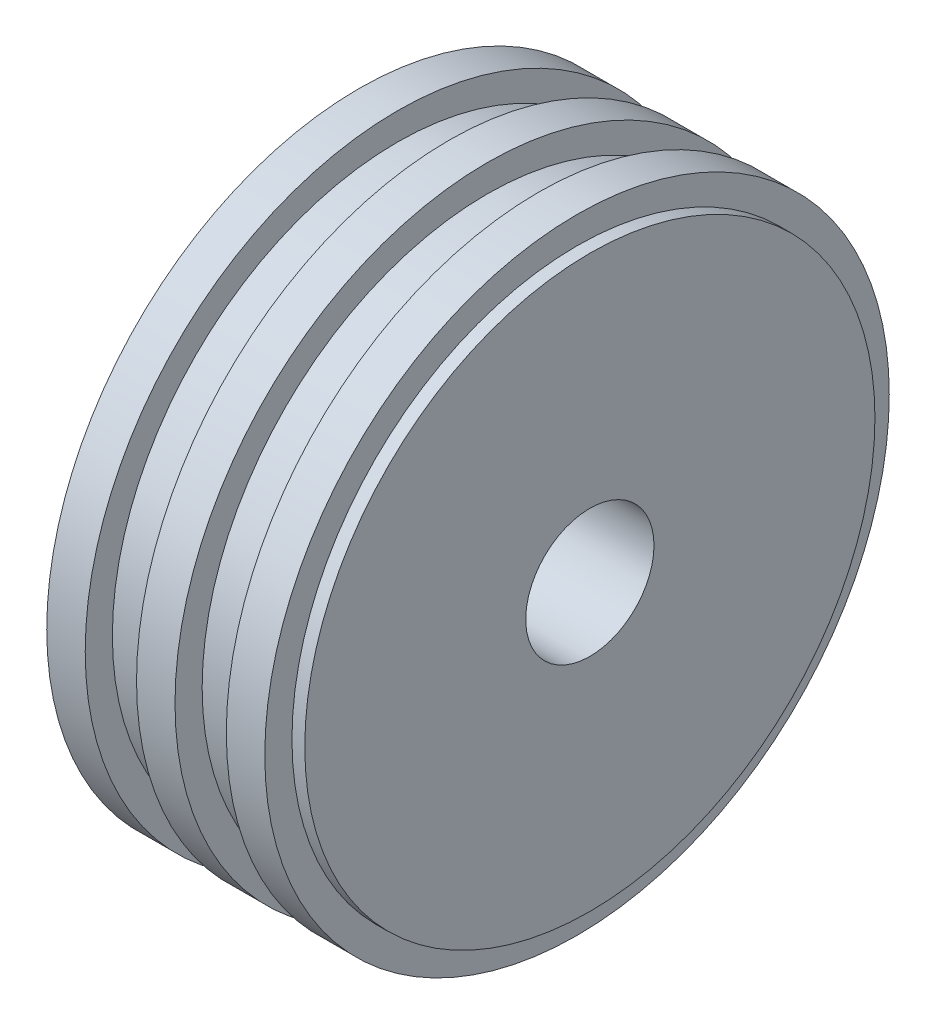
from build123d import *


with BuildPart() as part:
    # Sketch1 → Revolve1 (revolve)
    with BuildSketch(Plane(origin=(0, 0, 0), x_dir=(1, 0, 0), z_dir=(0, 1, 0))):
        Polygon((-57, 15), (-57, 66.675), (-54, 66.675), (-54, 73.025), (-45, 73.025), (-45, 66.675), (-33, 66.675), (-33, 73.025), (-24, 73.025), (-24, 66.675), (-12, 66.675), (-12, 73.025), (-3, 73.025), (-3, 66.675), (0, 66.675), (0, 15), align=None)
    revolve(axis=Axis((0, 0, 0), (-1, 0, 0)))


solid = part.part
